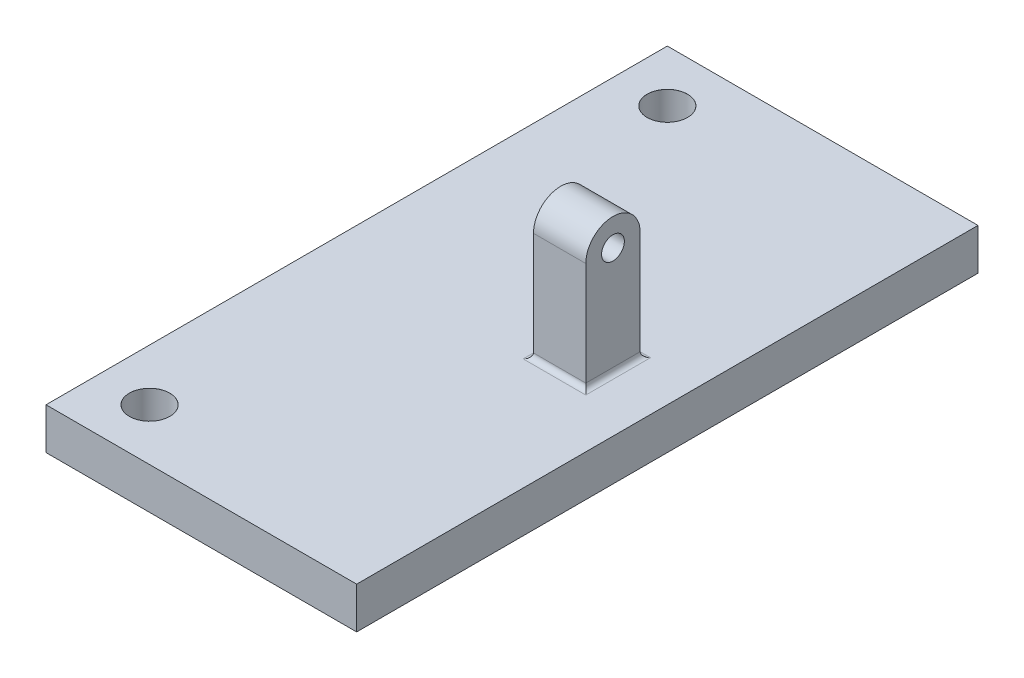
from build123d import *

# Parameters (mm, degrees)
BOSS_EXTRUDE1_DEPTH                    = 50.5
TAP_DRILL_FOR_M24X2_0_TAP1_D           = 22
TAP_DRILL_FOR_M24X2_0_TAP1_CSINK_D     = 22.05
TAP_DRILL_FOR_M24X2_0_TAP1_CSINK_ANGLE = 90
BOSS_EXTRUDE2_DEPTH                    = 40
FILLET1_R                              = 5
TAP_DRILL_FOR_M42X3_0_TAP1_D           = 39
TAP_DRILL_FOR_M42X3_0_TAP1_CSINK_D     = 39.05
TAP_DRILL_FOR_M42X3_0_TAP1_CSINK_ANGLE = 90


with BuildPart() as part:
    # Sketch1 → Boss-Extrude1 (new body)
    with BuildSketch(Plane(origin=(0, 0, 0), x_dir=(0, 0, -1), z_dir=(1, 0, 0))):
        with BuildLine():
            Line((-26.25, 0), (-26.25, -105))
            Line((-26.25, -105), (26.25, -105))
            Line((26.25, -105), (26.25, 0))
            ThreePointArc((26.25, 0), (0, 26.25), (-26.25, 0))
        make_face()
    extrude(amount=BOSS_EXTRUDE1_DEPTH)

    # Tap Drill for M24x2.0 Tap1 (through all)
    with Locations(Plane.ZY):
        with Locations((0, 0)):
            CounterSinkHole(TAP_DRILL_FOR_M24X2_0_TAP1_D / 2, TAP_DRILL_FOR_M24X2_0_TAP1_CSINK_D / 2, counter_sink_angle=TAP_DRILL_FOR_M24X2_0_TAP1_CSINK_ANGLE)

    # Sketch6 → Boss-Extrude2 (add)
    with BuildSketch(Plane.XZ.offset(105)):
        Polygon((103, 0), (103, 300), (-197, 300), (-197, -300), (103, -300), align=None)
    extrude(amount=BOSS_EXTRUDE2_DEPTH)

    # Fillet1
    fillet1_edges = [part.edges().sort_by_distance(p)[0] for p in [
        (50.5, -105, 0),
        (0, -105, 0),
        (25.25, -105, -26.25),
        (25.25, -105, 26.25),
    ]]
    fillet(fillet1_edges, radius=FILLET1_R)

    # Tap Drill for M42x3.0 Tap1 (through all)
    with Locations(Plane(origin=(0, -105, 0), x_dir=(1, 0, 0), z_dir=(0, 1, 0))):
        with Locations((-147, 250), (-147, -250)):
            CounterSinkHole(TAP_DRILL_FOR_M42X3_0_TAP1_D / 2, TAP_DRILL_FOR_M42X3_0_TAP1_CSINK_D / 2, counter_sink_angle=TAP_DRILL_FOR_M42X3_0_TAP1_CSINK_ANGLE)


solid = part.part
